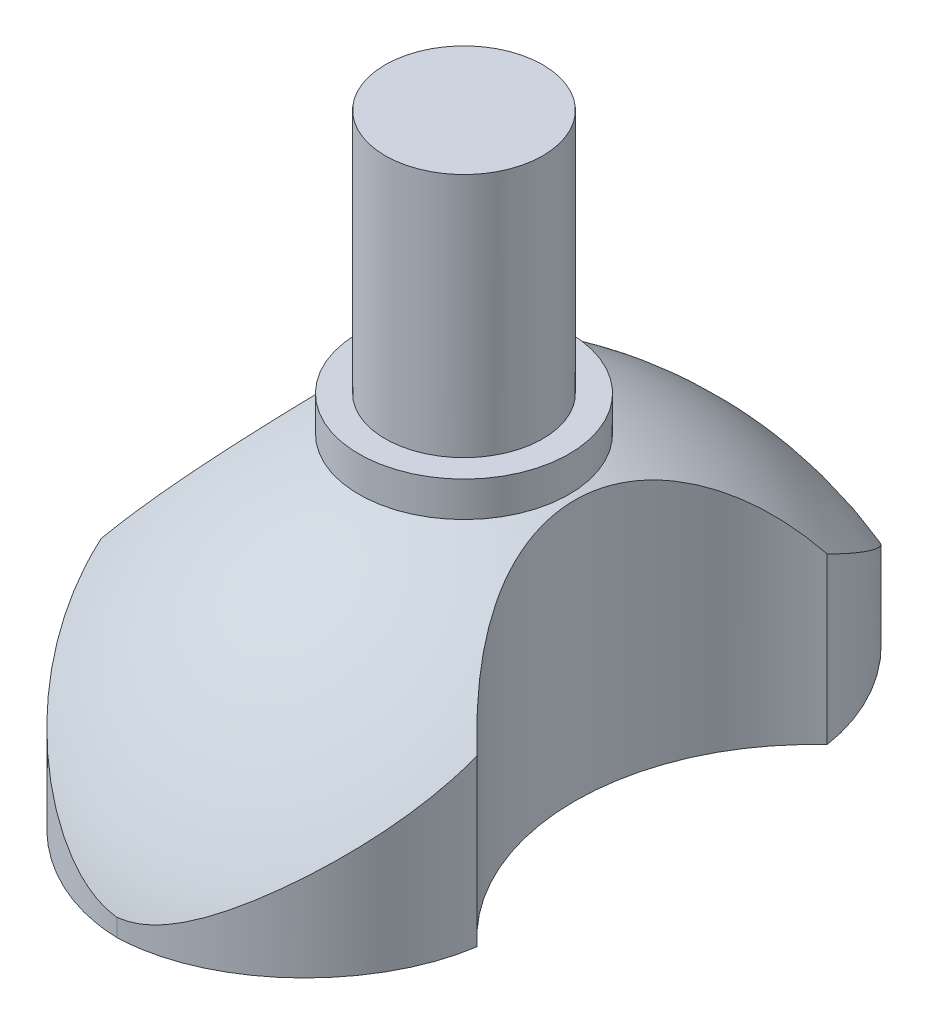
from build123d import *

# Parameters (mm, degrees)
SKETCH1_R           = 5
SKETCH1_R_2         = 3
BOSS_EXTRUDE2_DEPTH = 17.5
SKETCH4_W           = 18
SKETCH4_H           = 1
EXTRUDE_THIN1_DEPTH = 35
CIRPATTERN1_COUNT   = 9
SKETCH5_R           = 3
BOSS_EXTRUDE3_DEPTH = 15
SKETCH6_R           = 3.5
SKETCH6_R_2         = 1.5
CUT_EXTRUDE1_DEPTH  = 6
SKETCH15_R          = 1.5
CUT_EXTRUDE2_DEPTH  = 2
SKETCH17_R          = 2.5
BOSS_EXTRUDE4_DEPTH = 3
SKETCH18_R          = 2
CUT_EXTRUDE3_DEPTH  = 2
SKETCH19_R          = 4
CUT_EXTRUDE4_DEPTH  = 20
SKETCH20_W          = 45.677284088
SKETCH20_H          = 45.724664858
CUT_EXTRUDE5_DEPTH  = 8
SKETCH21_R          = 3
BOSS_EXTRUDE5_DEPTH = 1
SKETCH24_R          = 9.912143672
BOSS_EXTRUDE6_DEPTH = 0.5
SKETCH25_R          = 3.2
CUT_EXTRUDE6_DEPTH  = 2.1
SKETCH26_R          = 3.2
BOSS_EXTRUDE7_DEPTH = 0.25
CUT_EXTRUDE8_START  = -7.5
CUT_EXTRUDE8_DEPTH  = 7.5
SKETCH28_R          = 0.5
CUT_EXTRUDE9_DEPTH  = 1.5
CUT_EXTRUDE10_DEPTH = 7
BOSS_EXTRUDE8_START = 10
SKETCH30_R          = 4
BOSS_EXTRUDE8_DEPTH = 10
CUT_EXTRUDE12_START = -20
SKETCH31_R          = 2.25
CUT_EXTRUDE12_DEPTH = 20
SKETCH32_R          = 2.25
CUT_EXTRUDE13_DEPTH = 10


with BuildPart() as part:
    # Sketch1 → Boss-Extrude2 (new, symmetric)
    with BuildSketch(Plane(origin=(0, 0, 0), x_dir=(1, 0, 0), z_dir=(0, 1, 0))):
        with Locations(Location((0, 0, 0), (0, 0, 270))):
            Circle(SKETCH1_R)
        with Locations(Location((0, 0, 0), (0, 0, 270))):
            Circle(SKETCH1_R_2, mode=Mode.SUBTRACT)
    extrude(amount=BOSS_EXTRUDE2_DEPTH, both=True)

    # Sketch4 → Extrude-Thin1 (add)
    with BuildSketch(Plane(origin=(0, 17.5, 0), x_dir=(1, 0, 0), z_dir=(0, 1, 0))):
        with Locations((12, 0)):
            Rectangle(SKETCH4_W, SKETCH4_H)
    extrude_thin1 = extrude(amount=-EXTRUDE_THIN1_DEPTH)

    # CirPattern1: Extrude-Thin1 ×9 about axis
    cirpattern1_axis = Axis((0, 0, 0), (0, 1, 0))
    for i in range(1, CIRPATTERN1_COUNT):
        add(extrude_thin1.rotate(cirpattern1_axis, i * 360 / CIRPATTERN1_COUNT))

    # Sketch5 → Boss-Extrude3 (add)
    with BuildSketch(Plane(origin=(0, -17.5, 0), x_dir=(-1, 0, 0), z_dir=(0, -1, 0))):
        with Locations(Location((0, 0, 0), (0, 0, 90))):
            Circle(SKETCH5_R)
    extrude(amount=-BOSS_EXTRUDE3_DEPTH)

    # Sketch6 → Cut-Extrude1 (cut)
    with BuildSketch(Plane(origin=(0, -17.5, 0), x_dir=(-1, 0, 0), z_dir=(0, -1, 0))):
        with Locations(Location((0, 0, 0), (0, 0, 90))):
            Circle(SKETCH6_R)
        with Locations(Location((0, 0, 0), (0, 0, 90))):
            Circle(SKETCH6_R_2, mode=Mode.SUBTRACT)
    extrude(amount=-CUT_EXTRUDE1_DEPTH, mode=Mode.SUBTRACT)

    # Sketch15 → Cut-Extrude2 (cut)
    with BuildSketch(Plane.XZ.offset(17.5)):
        with Locations(Location((0, 0, 0), (0, 0, 270))):
            Circle(SKETCH15_R)
    extrude(amount=-CUT_EXTRUDE2_DEPTH, mode=Mode.SUBTRACT)

    # Sketch17 → Boss-Extrude4 (add)
    with BuildSketch(Plane.XZ.offset(17.5)):
        with Locations((18.5, 0)):
            Circle(SKETCH17_R)
    extrude(amount=-BOSS_EXTRUDE4_DEPTH)

    # Sketch18 → Cut-Extrude3 (cut)
    with BuildSketch(Plane.XZ.offset(17.5)):
        with Locations(Location((18.5, 0, 0), (0, 0, 270))):
            Circle(SKETCH18_R)
    extrude(amount=-CUT_EXTRUDE3_DEPTH, mode=Mode.SUBTRACT)

    # Sketch19 → Cut-Extrude4 (cut)
    with BuildSketch(Plane(origin=(0, 17.5, 0), x_dir=(1, 0, 0), z_dir=(0, 1, 0))):
        with Locations(Location((0, 0, 0), (0, 0, 270))):
            Circle(SKETCH19_R)
    extrude(amount=-CUT_EXTRUDE4_DEPTH, mode=Mode.SUBTRACT)

    # Sketch20 → Cut-Extrude5 (cut)
    with BuildSketch(Plane(origin=(0, -17.5, 0), x_dir=(-1, 0, 0), z_dir=(0, -1, 0))):
        Rectangle(SKETCH20_W, SKETCH20_H)
    extrude(amount=-CUT_EXTRUDE5_DEPTH, mode=Mode.SUBTRACT)

    # Sketch21 → Boss-Extrude5 (add)
    with BuildSketch(Plane.XZ.offset(9.5)):
        with Locations(Location((0, 0, 0), (0, 0, 90))):
            Circle(SKETCH21_R)
    extrude(amount=BOSS_EXTRUDE5_DEPTH)

    # Sketch23 → Revolve1 (revolve)
    with BuildSketch(Plane(origin=(0, 0, 0), x_dir=(0, 0, -1), z_dir=(1, 0, 0))):
        with BuildLine():
            Line((-3, -10.5), (-2, -10.5))
            Line((-2, -10.5), (0, -10.5))
            Line((0, -10.5), (0, -17.5))
            Line((0, -17.5), (-8.912143672, -17.5))
            Line((-8.912143672, -17.5), (-9.912143672, -17.5))
            ThreePointArc((-9.912143672, -17.5), (-7.260403323, -13.2057636), (-3, -10.5))
        make_face()
    revolve(axis=Axis((0, -11.130650603, 0), (0, -1, 0)))

    # Sketch24 → Boss-Extrude6 (add)
    with BuildSketch(Plane.XZ.offset(17.5)):
        with Locations(Location((0, 0, 0), (0, 0, 270))):
            Circle(SKETCH24_R)
    extrude(amount=BOSS_EXTRUDE6_DEPTH)

    # Sketch25 → Cut-Extrude6 (cut)
    with BuildSketch(Plane.XZ.offset(18)):
        with Locations(Location((-0.56668442, 5, 0), (0, 0, 270))):
            Circle(SKETCH25_R)
    extrude(amount=-CUT_EXTRUDE6_DEPTH, mode=Mode.SUBTRACT)

    # Sketch26 → Boss-Extrude7 (add)
    with BuildSketch(Plane.XZ.offset(18)):
        with Locations(Location((-0.56668442, 5, 0), (0, 0, 270))):
            Circle(SKETCH26_R)
    extrude(amount=-BOSS_EXTRUDE7_DEPTH)

    # Sketch27 → Cut-Extrude8 (cut)
    with BuildSketch(Plane.XZ.offset(18).offset(CUT_EXTRUDE8_START)):
        with BuildLine():
            ThreePointArc((-5.368630905, 4.991892601), (-6.424807204, 5.779358473), (-7.613826501, 6.346671425))
            ThreePointArc((-7.613826501, 6.346671425), (-9.912143672, 0), (-7.613826501, -6.346671425))
            ThreePointArc((-7.613826501, -6.346671425), (-6.424807204, -5.779358473), (-5.368630905, -4.991892601))
            ThreePointArc((-5.368630905, -4.991892601), (-3.162143672, 0), (-5.368630905, 4.991892601))
        make_face()
        with BuildLine():
            ThreePointArc((9.912143672, 0), (9.319869483, 3.375), (7.613826501, 6.346671425))
            ThreePointArc((7.613826501, 6.346671425), (6.424807204, 5.779358473), (5.368630905, 4.991892601))
            ThreePointArc((5.368630905, 4.991892601), (3.162143672, 0), (5.368630905, -4.991892601))
            ThreePointArc((5.368630905, -4.991892601), (6.424807204, -5.779358473), (7.613826501, -6.346671425))
            ThreePointArc((7.613826501, -6.346671425), (9.319869483, -3.375), (9.912143672, 0))
        make_face()
        with BuildLine():
            ThreePointArc((-5.368630905, -4.991892601), (-6.424807204, -5.779358473), (-7.613826501, -6.346671425))
            ThreePointArc((-7.613826501, -6.346671425), (-4.203657524, -8.976628297), (0, -9.912143672))
            add(Edge.make_bspline(
                [(-5.368630905, -4.991892601), (-4.998119196, -7.539682857), (-2.616364035, -9.837937814), (0, -9.912143672)],
                knots=[0, 0, 0, 0, 1, 1, 1, 1], degree=3))
        make_face()
        with BuildLine():
            add(Edge.make_bspline(
                [(5.368630905, -4.991892601), (4.998119196, -7.539682857), (2.616364035, -9.837937814), (0, -9.912143672)],
                knots=[0, 0, 0, 0, 1, 1, 1, 1], degree=3))
            ThreePointArc((0, -9.912143672), (4.203657524, -8.976628297), (7.613826501, -6.346671425))
            ThreePointArc((7.613826501, -6.346671425), (6.424807204, -5.779358473), (5.368630905, -4.991892601))
        make_face()
        with BuildLine():
            ThreePointArc((0, 9.912143672), (-4.203657524, 8.976628297), (-7.613826501, 6.346671425))
            ThreePointArc((-7.613826501, 6.346671425), (-6.424807204, 5.779358473), (-5.368630905, 4.991892601))
            add(Edge.make_bspline(
                [(-5.368630905, 4.991892601), (-4.998119196, 7.539682857), (-2.616364035, 9.837937814), (0, 9.912143672)],
                knots=[0, 0, 0, 0, 1, 1, 1, 1], degree=3))
        make_face()
        with BuildLine():
            ThreePointArc((7.613826501, 6.346671425), (4.203657524, 8.976628297), (0, 9.912143672))
            add(Edge.make_bspline(
                [(5.368630905, 4.991892601), (4.998119196, 7.539682857), (2.616364035, 9.837937814), (0, 9.912143672)],
                knots=[0, 0, 0, 0, 1, 1, 1, 1], degree=3))
            ThreePointArc((5.368630905, 4.991892601), (6.424807204, 5.779358473), (7.613826501, 6.346671425))
        make_face()
    extrude(amount=CUT_EXTRUDE8_DEPTH, mode=Mode.SUBTRACT)

    # Sketch28 → Cut-Extrude9 (cut)
    with BuildSketch(Plane.XZ.offset(18)):
        with Locations(Location((0, 0, 0), (0, 0, 270))):
            Circle(SKETCH28_R)
    extrude(amount=-CUT_EXTRUDE9_DEPTH, mode=Mode.SUBTRACT)

    # Sketch29 → Cut-Extrude10 (cut)
    with BuildSketch(Plane(origin=(0, 17.5, 0), x_dir=(1, 0, 0), z_dir=(0, 1, 0))):
        with BuildLine():
            Line((3.489629181, -3.580850203), (15.765539501, -13.881562025))
            Line((15.765539501, -13.881562025), (16.40832711, -13.115517582))
            Line((16.40832711, -13.115517582), (4.132416791, -2.81480576))
            ThreePointArc((4.132416791, -2.81480576), (4.698463104, -1.710100717), (4.974937186, -0.5))
            Line((4.974937186, -0.5), (21, -0.5))
            Line((21, -0.5), (21, 0.5))
            Line((21, 0.5), (4.974937186, 0.5))
            ThreePointArc((4.974937186, 0.5), (4.698463104, 1.710100717), (4.132416791, 2.81480576))
            Line((4.132416791, 2.81480576), (16.40832711, 13.115517582))
            Line((16.40832711, 13.115517582), (15.765539501, 13.881562025))
            Line((15.765539501, 13.881562025), (3.489629181, 3.580850203))
            ThreePointArc((3.489629181, 3.580850203), (2.5, 4.330127019), (1.356292653, 4.812532622))
            Line((1.356292653, 4.812532622), (4.139015608, 20.594138724))
            Line((4.139015608, 20.594138724), (3.154207854, 20.767786902))
            Line((3.154207854, 20.767786902), (0.3714849, 4.9861808))
            ThreePointArc((0.3714849, 4.9861808), (-0.868240888, 4.924038765), (-2.054455891, 4.558421985))
            Line((-2.054455891, 4.558421985), (-10.066987298, 18.436533479))
            Line((-10.066987298, 18.436533479), (-10.933012702, 17.936533479))
            Line((-10.933012702, 17.936533479), (-2.920481295, 4.058421985))
            ThreePointArc((-2.920481295, 4.058421985), (-3.830222216, 3.213938048), (-4.50390169, 2.17137504))
            Line((-4.50390169, 2.17137504), (-19.562534965, 7.65226932))
            Line((-19.562534965, 7.65226932), (-19.904555108, 6.712576699))
            Line((-19.904555108, 6.712576699), (-4.845921834, 1.231682419))
            ThreePointArc((-4.845921834, 1.231682419), (-5, 0), (-4.845921834, -1.231682419))
            Line((-4.845921834, -1.231682419), (-19.904555108, -6.712576699))
            Line((-19.904555108, -6.712576699), (-19.562534965, -7.65226932))
            Line((-19.562534965, -7.65226932), (-4.50390169, -2.17137504))
            ThreePointArc((-4.50390169, -2.17137504), (-3.830222216, -3.213938048), (-2.920481295, -4.058421985))
            Line((-2.920481295, -4.058421985), (-10.933012702, -17.936533479))
            Line((-10.933012702, -17.936533479), (-10.066987298, -18.436533479))
            Line((-10.066987298, -18.436533479), (-2.054455891, -4.558421985))
            ThreePointArc((-2.054455891, -4.558421985), (-0.868240888, -4.924038765), (0.3714849, -4.9861808))
            Line((0.3714849, -4.9861808), (3.154207854, -20.767786902))
            Line((3.154207854, -20.767786902), (4.139015608, -20.594138724))
            Line((4.139015608, -20.594138724), (1.356292653, -4.812532622))
            ThreePointArc((1.356292653, -4.812532622), (2.5, -4.330127019), (3.489629181, -3.580850203))
        make_face()
    extrude(amount=-CUT_EXTRUDE10_DEPTH, mode=Mode.SUBTRACT)

    # Sketch30 → Boss-Extrude8 (add)
    with BuildSketch(Plane(origin=(0, -2.5, 0), x_dir=(1, 0, 0), z_dir=(0, 1, 0)).offset(BOSS_EXTRUDE8_START)):
        with Locations(Location((0, 0, 0), (0, 0, 270))):
            Circle(SKETCH30_R)
    extrude(amount=-BOSS_EXTRUDE8_DEPTH)

    # Sketch31 → Cut-Extrude12 (cut)
    with BuildSketch(Plane.XZ.offset(9.5).offset(CUT_EXTRUDE12_START)):
        with BuildLine():
            Line((-2.054455891, 4.558421985), (-10.066987298, 18.436533479))
            Line((-10.066987298, 18.436533479), (-10.933012702, 17.936533479))
            Line((-10.933012702, 17.936533479), (-2.920481295, 4.058421985))
            ThreePointArc((-2.920481295, 4.058421985), (-3.830222216, 3.213938048), (-4.50390169, 2.17137504))
            Line((-4.50390169, 2.17137504), (-19.562534965, 7.65226932))
            Line((-19.562534965, 7.65226932), (-19.904555108, 6.712576699))
            Line((-19.904555108, 6.712576699), (-4.845921834, 1.231682419))
            ThreePointArc((-4.845921834, 1.231682419), (-5, 0), (-4.845921834, -1.231682419))
            Line((-4.845921834, -1.231682419), (-19.904555108, -6.712576699))
            Line((-19.904555108, -6.712576699), (-19.562534965, -7.65226932))
            Line((-19.562534965, -7.65226932), (-4.50390169, -2.17137504))
            ThreePointArc((-4.50390169, -2.17137504), (-3.830222216, -3.213938048), (-2.920481295, -4.058421985))
            Line((-2.920481295, -4.058421985), (-10.933012702, -17.936533479))
            Line((-10.933012702, -17.936533479), (-10.066987298, -18.436533479))
            Line((-10.066987298, -18.436533479), (-2.054455891, -4.558421985))
            ThreePointArc((-2.054455891, -4.558421985), (-0.868240888, -4.924038765), (0.3714849, -4.9861808))
            Line((0.3714849, -4.9861808), (3.154207854, -20.767786902))
            Line((3.154207854, -20.767786902), (4.139015608, -20.594138724))
            Line((4.139015608, -20.594138724), (1.356292653, -4.812532622))
            ThreePointArc((1.356292653, -4.812532622), (2.5, -4.330127019), (3.489629181, -3.580850203))
            Line((3.489629181, -3.580850203), (15.765539501, -13.881562025))
            Line((15.765539501, -13.881562025), (16.40832711, -13.115517582))
            Line((16.40832711, -13.115517582), (4.132416791, -2.81480576))
            ThreePointArc((4.132416791, -2.81480576), (4.698463104, -1.710100717), (4.974937186, -0.5))
            Line((4.974937186, -0.5), (21, -0.5))
            Line((21, -0.5), (21, 0.5))
            Line((21, 0.5), (4.974937186, 0.5))
            ThreePointArc((4.974937186, 0.5), (4.698463104, 1.710100717), (4.132416791, 2.81480576))
            Line((4.132416791, 2.81480576), (16.40832711, 13.115517582))
            Line((16.40832711, 13.115517582), (15.765539501, 13.881562025))
            Line((15.765539501, 13.881562025), (3.489629181, 3.580850203))
            ThreePointArc((3.489629181, 3.580850203), (2.5, 4.330127019), (1.356292653, 4.812532622))
            Line((1.356292653, 4.812532622), (4.139015608, 20.594138724))
            Line((4.139015608, 20.594138724), (3.154207854, 20.767786902))
            Line((3.154207854, 20.767786902), (0.3714849, 4.9861808))
            ThreePointArc((0.3714849, 4.9861808), (-0.868240888, 4.924038765), (-2.054455891, 4.558421985))
        make_face()
        with Locations(Location((0, 0, 0), (0, 0, 270))):
            Circle(SKETCH31_R, mode=Mode.SUBTRACT)
    extrude(amount=CUT_EXTRUDE12_DEPTH, mode=Mode.SUBTRACT)

    # Sketch32 → Cut-Extrude13 (cut)
    with BuildSketch(Plane(origin=(0, 7.5, 0), x_dir=(1, 0, 0), z_dir=(0, 1, 0))):
        with Locations(Location((0, 0, 0), (0, 0, 90))):
            Circle(SKETCH32_R)
    extrude(amount=-CUT_EXTRUDE13_DEPTH, mode=Mode.SUBTRACT)


solid = part.part
